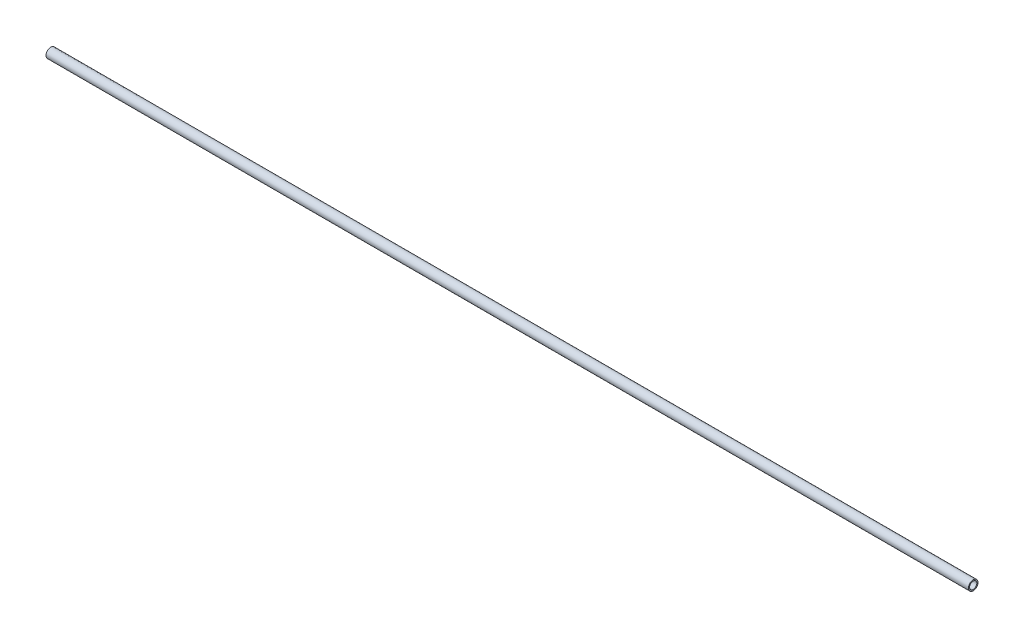
from build123d import *

# Parameters (mm, degrees)
SKETCH1_R           = 9.525
SKETCH1_R_2         = 7.112
BOSS_EXTRUDE1_DEPTH = 1828.8


with BuildPart() as part:
    # Sketch1 → Boss-Extrude1 (new body)
    with BuildSketch(Plane(origin=(0, 0, 0), x_dir=(0, 0, -1), z_dir=(1, 0, 0))):
        with Locations(Location((0, 0, 0), (0, 0, 180))):
            Circle(SKETCH1_R)
        with Locations(Location((0, 0, 0), (0, 0, 180))):
            Circle(SKETCH1_R_2, mode=Mode.SUBTRACT)
    extrude(amount=BOSS_EXTRUDE1_DEPTH)


solid = part.part
